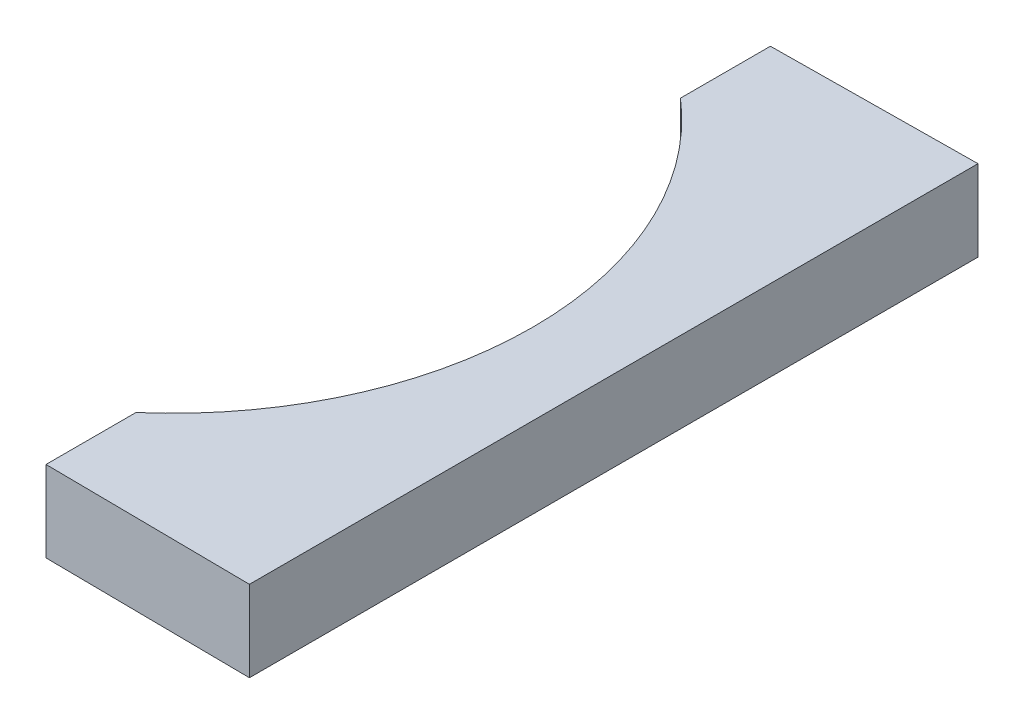
from build123d import *

# Parameters (mm, degrees)
BOSS_EXTRUDE1_DEPTH = 0.9


with BuildPart() as part:
    # Sketch1 → Boss-Extrude1 (new body)
    with BuildSketch(Plane(origin=(0, 0, 0), x_dir=(1, 0, 0), z_dir=(0, 1, 0))):
        with BuildLine():
            Line((4.9, 4.05), (2.615181585, 4.026685526))
            Line((2.615181585, 4.026685526), (2.615181585, 3.026685526))
            ThreePointArc((2.615181585, 3.026685526), (4, 0), (2.615181585, -3.026685526))
            Line((2.615181585, -3.026685526), (2.615181585, -4.026685526))
            Line((2.615181585, -4.026685526), (4.9, -4.05))
            Line((4.9, -4.05), (4.9, 4.05))
        make_face()
    extrude(amount=BOSS_EXTRUDE1_DEPTH)


solid = part.part
